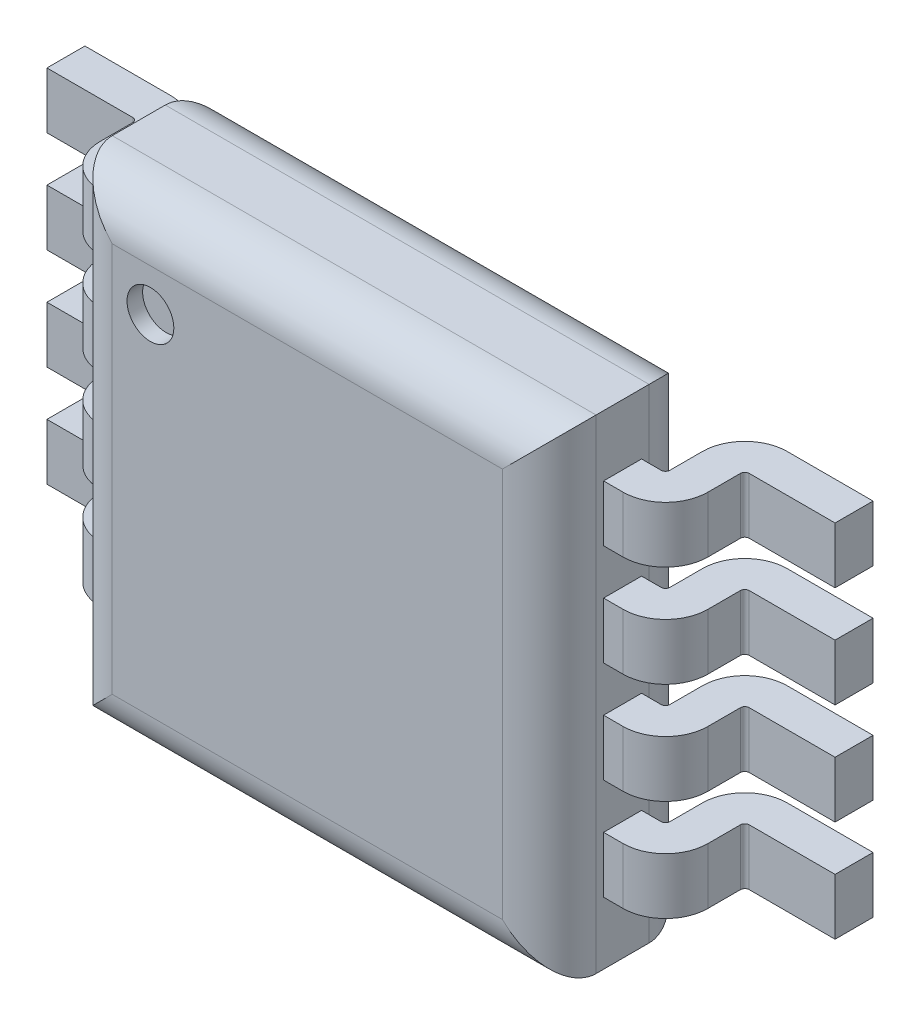
from build123d import *

# Parameters (mm, degrees)
SKETCH_3_W          = 3.1
SKETCH_3_H          = 3.1
EXTRUDE_1_DEPTH     = 0.94
FILLET_2_R          = 0.3
SKETCH_4_R          = 0.15
CUT_EXTRUDE_1_DEPTH = 0.1
SKETCH_5_W          = 0.243392782
SKETCH_5_H          = 0.36


with BuildPart() as part:
    # Эскиз3 → Вытянуть1 (new body)
    with BuildSketch(Plane.XY.offset(1.1)):
        with Locations((2.175, -0.98)):
            Rectangle(SKETCH_3_W, SKETCH_3_H)
    extrude(amount=-EXTRUDE_1_DEPTH)

    # Скругление2
    fillet_2_edges = [part.edges().sort_by_distance(p)[0] for p in [
        (2.175, 0.57, 1.1),
        (2.175, 0.57, 0.16),
        (3.725, -0.98, 1.1),
        (3.725, -0.98, 0.16),
        (2.175, -2.53, 1.1),
        (2.175, -2.53, 0.16),
        (0.625, -0.98, 1.1),
        (0.625, -0.98, 0.16),
    ]]
    fillet(fillet_2_edges, radius=FILLET_2_R)

    # Эскиз4 → Вырез-Вытянуть1 (cut)
    with BuildSketch(Plane.XY.offset(1.1)):
        with Locations((1.169675261, 0)):
            Circle(SKETCH_4_R)
    extrude(amount=-CUT_EXTRUDE_1_DEPTH, mode=Mode.SUBTRACT)

    # По траектории4: sweep along a path in Эскиз6
    with BuildLine(Plane(origin=(0, 0, 0), x_dir=(1, 0, 0), z_dir=(0, 1, 0))) as sweep_4_path:
        Line((-0.35, -0.121696391), (0.2, -0.121696391))
        ThreePointArc((0.2, -0.121696391), (0.306066017, -0.165630374), (0.35, -0.271696391))
        Line((0.35, -0.271696391), (0.35, -0.48))
        ThreePointArc((0.35, -0.48), (0.393933983, -0.586066017), (0.5, -0.63))
        Line((0.5, -0.63), (0.625, -0.63))
        Line((0.625, -0.63), (3.725, -0.63))
        Line((3.725, -0.63), (3.85, -0.63))
        ThreePointArc((3.85, -0.63), (3.956066017, -0.586066017), (4, -0.48))
        Line((4, -0.48), (4, -0.271696391))
        ThreePointArc((4, -0.271696391), (4.043933983, -0.165630374), (4.15, -0.121696391))
        Line((4.15, -0.121696391), (4.7, -0.121696391))
    # Эскиз5 → По траектории4 (sweep)
    with BuildSketch(Plane(origin=(-0.35, 0, 0), x_dir=(0, 0, -1), z_dir=(1, 0, 0))):
        with Locations((-0.121696391, -0.65)):
            Rectangle(SKETCH_5_W, SKETCH_5_H)
        with Locations((-0.121696391, 0)):
            Rectangle(SKETCH_5_W, SKETCH_5_H)
        with Locations((-0.121696391, -1.3)):
            Rectangle(SKETCH_5_W, SKETCH_5_H)
        with Locations((-0.121696391, -1.95)):
            Rectangle(SKETCH_5_W, SKETCH_5_H)
    sweep(path=sweep_4_path.line)


solid = part.part
